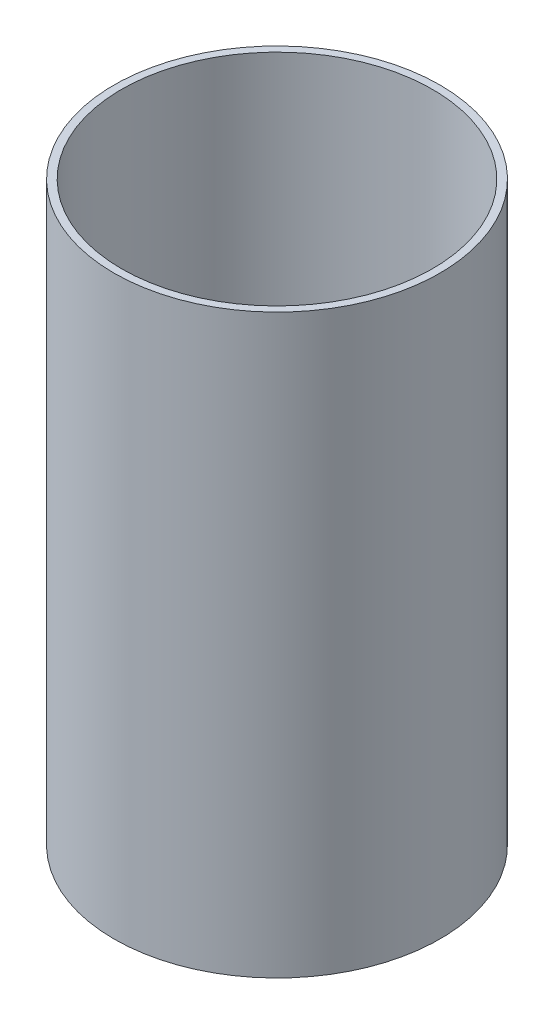
from build123d import *

# Parameters (mm, degrees)
SKETCH1_R           = 32.5
SKETCH1_R_2         = 31
BOSS_EXTRUDE1_DEPTH = 115


with BuildPart() as part:
    # Sketch1 → Boss-Extrude1 (new body)
    with BuildSketch(Plane(origin=(0, 0, 0), x_dir=(1, 0, 0), z_dir=(0, 1, 0))):
        with Locations(Location((0, 0, 0), (0, 0, 270))):
            Circle(SKETCH1_R)
        with Locations(Location((0, 0, 0), (0, 0, 270))):
            Circle(SKETCH1_R_2, mode=Mode.SUBTRACT)
    extrude(amount=BOSS_EXTRUDE1_DEPTH)


solid = part.part
